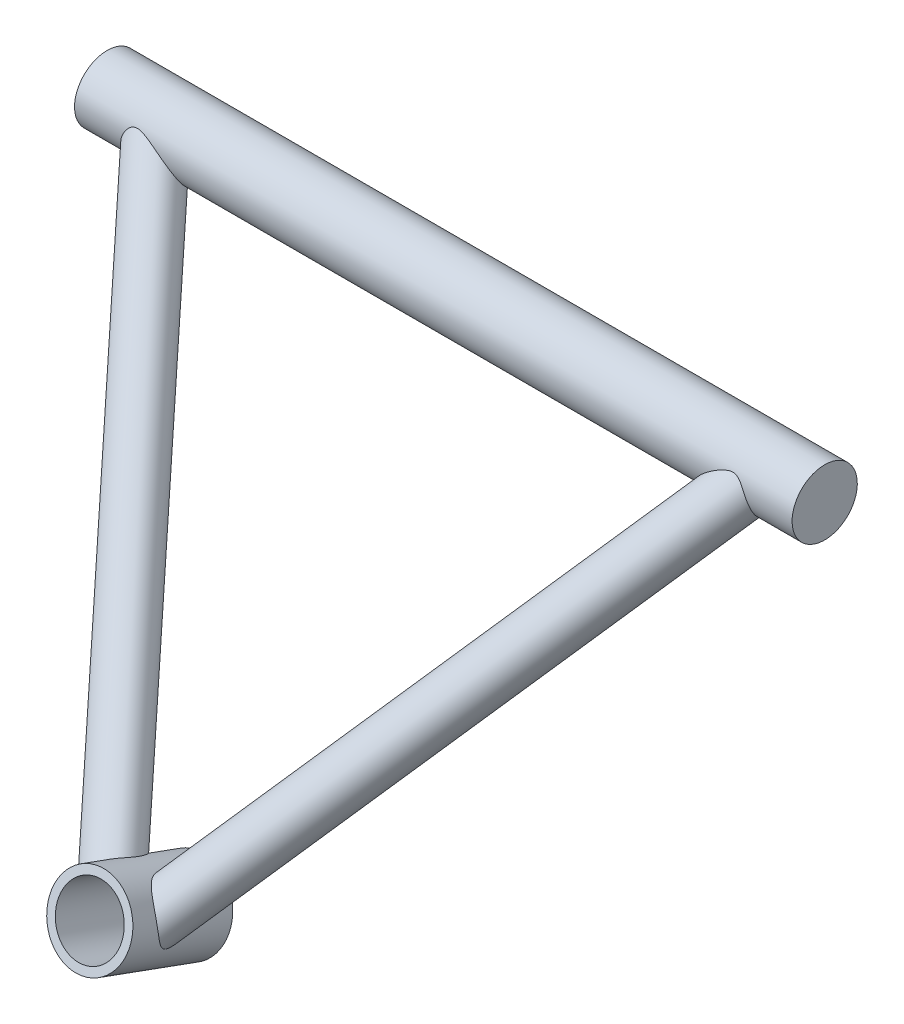
from build123d import *

# Parameters (mm, degrees)
SKETCH1_R               = 15.875
BOSS_EXTRUDE1_DEPTH     = 20.701
SWEEP1_PROFILE_R        = 9.525
SWEEP2_PROFILE_R        = 9.525
CUT_EXTRUDE2_REACH      = 335.408
SKETCH36_R              = 7.9375
CUT_EXTRUDE3_REACH      = 335.408
CUT_EXTRUDE3_END_RADIUS = 15.875
SKETCH37_R              = 7.9375
SKETCH77_R              = 15.875
BOSS_EXTRUDE2_DEPTH     = 41.402
CUT_EXTRUDE1_REACH      = 237.507
SKETCH2_R               = 12.7
SWEEP5_PROFILE_R        = 12.7


with BuildPart() as part:
    # Sketch1 → Boss-Extrude1 (new, symmetric)
    with BuildSketch(Plane(origin=(0, 0, 0), x_dir=(1, 0, 0), z_dir=(0, 0.34202014332566943, 0.9396926207859081))):
        with Locations(Location((0, 0, 0), (0, 0, 270))):
            Circle(SKETCH1_R)
    extrude(amount=BOSS_EXTRUDE1_DEPTH, both=True)

    # Sweep1: sweep along a path in Sketch4
    with BuildLine(Plane(origin=(0, 3.157607018, 3.506877871), x_dir=(1, 0, 0), z_dir=(0, 0.6691306063588593, 0.7431448254773932))) as sweep1_path:
        Line((-5.08, -4.24897935), (-119.38, 193.724427955))
    # Sweep1 profile (on start of the path) → Sweep1 (sweep)
    with BuildSketch(Plane(origin=(-5.08, 0, 6.35), x_dir=(0, 0.6691306063588593, 0.7431448254773932), z_dir=(-0.5000000000000013, 0.6435822975543751, -0.579484103556457))):
        Circle(SWEEP1_PROFILE_R)
    sweep(path=sweep1_path.line)

    # Sweep2: sweep along a path in Sketch15
    with BuildLine(Plane(origin=(0, 3.157607018, 3.506877871), x_dir=(1, 0, 0), z_dir=(0, 0.6691306063588593, 0.7431448254773932))) as sweep2_path:
        Line((5.08, -4.24897935), (119.38, 193.724427955))
    # Sweep2 profile (on start of the path) → Sweep2 (sweep)
    with BuildSketch(Plane(origin=(5.08, 0, 6.35), x_dir=(0, 0.6691306063588593, 0.7431448254773932), z_dir=(0.500000000000001, 0.6435822975543752, -0.579484103556457))):
        Circle(SWEEP2_PROFILE_R)
    sweep(path=sweep2_path.line)

    # Sketch36 → Cut-Extrude2 (cut, up to next)
    with BuildSketch(Plane(origin=(-113.730137971, 146.389406993, -131.809614099), x_dir=(0.8658626364039242, 0.3844750819133864, -0.32009499569243616), z_dir=(-0.5000000000000012, 0.643582297554375, -0.5794841035564573)), mode=Mode.PRIVATE) as cut_extrude2_sk1:
        with Locations(Location((-6.431185416, -4.844562232, 0), (0, 0, 271.110868888))):
            Circle(SKETCH36_R)
    cut_extrude2_tool1 = extrude(cut_extrude2_sk1.sketch, amount=-CUT_EXTRUDE2_REACH, mode=Mode.PRIVATE) & part.part
    add(cut_extrude2_tool1.solids().sort_by_distance((-119.38, 147.122913, -126.120066))[0], mode=Mode.SUBTRACT)

    # Cut-Extrude3: up to this cylinder (the profile starts outside it)
    cut_extrude3_end = Plane(origin=(0, -23.324096358, -64.082428074), z_dir=(0, -0.34202014332566943, -0.9396926207859081)) * Cylinder(CUT_EXTRUDE3_END_RADIUS, 703.566, mode=Mode.PRIVATE)
    # Sketch37 → Cut-Extrude3 (cut, up to the surface)
    with BuildSketch(Plane(origin=(113.730137971, 146.389406993, -131.809614099), x_dir=(0.8658626364039241, -0.38447508191338625, 0.32009499569243616), z_dir=(0.5000000000000011, 0.643582297554375, -0.5794841035564572)), mode=Mode.PRIVATE) as cut_extrude3_sk1:
        with Locations(Location((6.431185416, -4.844562232, 0), (0, 0, 268.889131112))):
            Circle(SKETCH37_R)
    cut_extrude3_tool1 = extrude(cut_extrude3_sk1.sketch, amount=-CUT_EXTRUDE3_REACH, mode=Mode.PRIVATE) - cut_extrude3_end
    add(cut_extrude3_tool1.solids().sort_by_distance((119.38, 147.122913, -126.120066))[0], mode=Mode.SUBTRACT)

    # Sketch77 → Boss-Extrude2 (add)
    with BuildSketch(Plane(origin=(0, 7.080158987, 19.452576943), x_dir=(1, 0, 0), z_dir=(0, 0.34202014332566943, 0.9396926207859082))):
        with Locations(Location((0, 0, 0), (0, 0, 270))):
            Circle(SKETCH77_R)
    extrude(amount=-BOSS_EXTRUDE2_DEPTH)

    # Sketch2 → Cut-Extrude1 (cut, up to next)
    with BuildSketch(Plane(origin=(0, -7.080158987, -19.452576943), x_dir=(-1, 0, 0), z_dir=(0, -0.34202014332566943, -0.9396926207859081)), mode=Mode.PRIVATE) as cut_extrude1_sk1:
        with Locations(Location((0, 0, 0), (0, 0, 90))):
            Circle(SKETCH2_R)
    cut_extrude1_tool1 = extrude(cut_extrude1_sk1.sketch, amount=-CUT_EXTRUDE1_REACH, mode=Mode.PRIVATE) & part.part
    add(cut_extrude1_tool1.solids().sort_by_distance((0, -7.080159, -19.452577))[0], mode=Mode.SUBTRACT)

    # Sweep5: sweep along a path in Sketch40
    with BuildLine(Plane(origin=(-106.934, 0, -127), x_dir=(1, 0, 0), z_dir=(0, 0, 1))) as sweep5_path:
        Line((-32.766, 144.78), (246.634, 144.78))
    # Sweep5 profile (on start of the path) → Sweep5 (sweep)
    with BuildSketch(Plane(origin=(-139.7, 144.78, -127), x_dir=(0, 1, 0), z_dir=(1, 0, 0))):
        Circle(SWEEP5_PROFILE_R)
    sweep(path=sweep5_path.line)


solid = part.part
